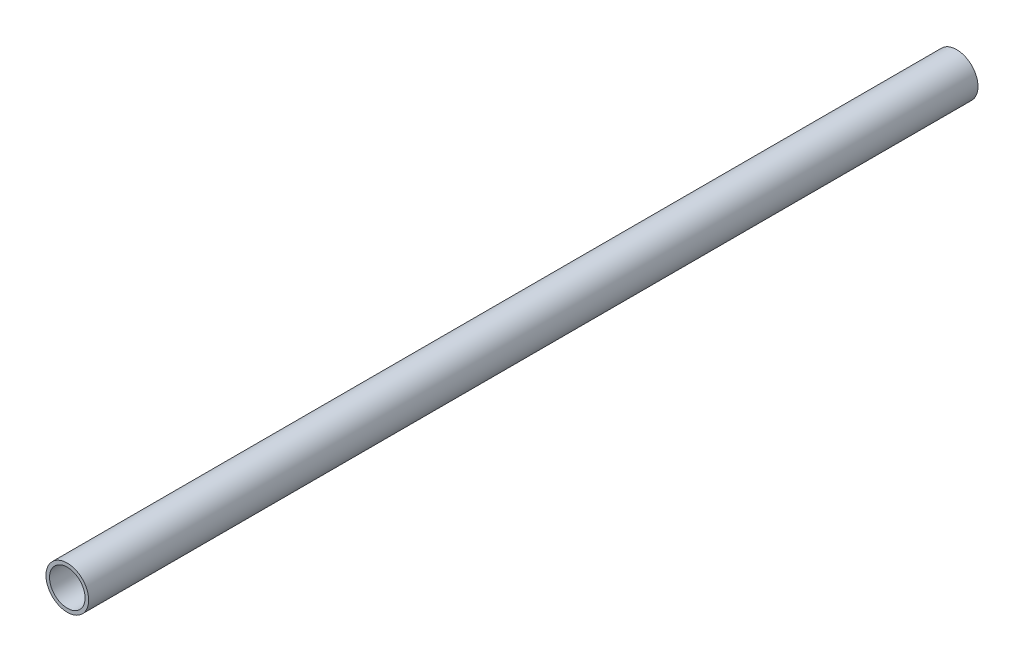
from build123d import *

# Parameters (mm, degrees)
ESQUISSE1_R        = 12
ESQUISSE1_R_2      = 10
BOSS_EXTRU_1_DEPTH = 500


with BuildPart() as part:
    # Esquisse1 → Boss.-Extru.1 (new body)
    with BuildSketch(Plane.XY):
        Circle(ESQUISSE1_R)
        Circle(ESQUISSE1_R_2, mode=Mode.SUBTRACT)
    extrude(amount=BOSS_EXTRU_1_DEPTH)


solid = part.part
